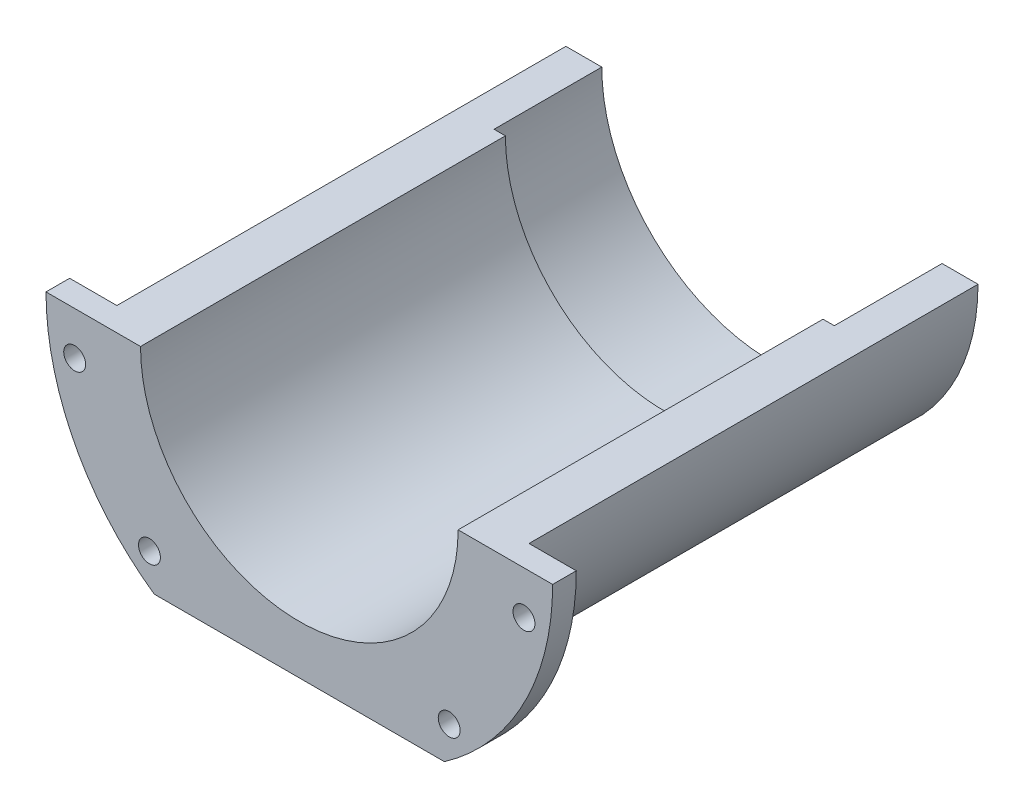
from build123d import *

# Parameters (mm, degrees)
SKETCH1_R               = 27.686
SKETCH1_R_2             = 21.336
BOSS_EXTRUDE1_DEPTH     = 63.5
BOSS_EXTRUDE2_START     = -3.175
SKETCH2_R               = 34.036
SKETCH2_R_2             = 27.686
BOSS_EXTRUDE2_DEPTH     = 3.175
CUT_EXTRUDE1_DEPTH      = 101.6
CUT_EXTRUDE1_DEPTH_BACK = 101.6
SKETCH3_W               = 97.716171251
SKETCH3_H               = 43.59719505
SKETCH4_R               = 1.4732
CUT_EXTRUDE2_DEPTH      = 101.6
SKETCH5_W               = 45.490276776
SKETCH5_H               = 8.374778988
CUT_EXTRUDE3_DEPTH      = 101.6
SKETCH6_R               = 22.86
CUT_EXTRUDE4_DEPTH      = 14.478


with BuildPart() as part:
    # Sketch1 → Boss-Extrude1 (new body)
    with BuildSketch(Plane.XY):
        Circle(SKETCH1_R)
        Circle(SKETCH1_R_2, mode=Mode.SUBTRACT)
    extrude(amount=BOSS_EXTRUDE1_DEPTH)

    # Sketch2 → Boss-Extrude2 (add)
    with BuildSketch(Plane.XY.offset(63.5).offset(BOSS_EXTRUDE2_START)):
        Circle(SKETCH2_R)
        Circle(SKETCH2_R_2, mode=Mode.SUBTRACT)
    extrude(amount=BOSS_EXTRUDE2_DEPTH)

    # Sketch3 → Cut-Extrude1 (cut, two sides: drawn at the far end of the back side and taken through both)
    with BuildSketch(Plane(origin=(0, 0, 60.325), x_dir=(-1, 0, 0), z_dir=(0, 0, -1)).offset(-CUT_EXTRUDE1_DEPTH_BACK)):
        with Locations((3.507260384, 21.798597525)):
            Rectangle(SKETCH3_W, SKETCH3_H)
    extrude(amount=CUT_EXTRUDE1_DEPTH + CUT_EXTRUDE1_DEPTH_BACK, mode=Mode.SUBTRACT)

    # Sketch4 → Cut-Extrude2 (cut)
    with BuildSketch(Plane(origin=(0, 0, 60.325), x_dir=(-1, 0, 0), z_dir=(0, 0, -1))):
        with Locations((-30.183908942, -5.789782577)):
            Circle(SKETCH4_R)
        with Locations((30.183908942, -5.789782577)):
            Circle(SKETCH4_R)
        with Locations((-20.137167868, -23.218191393)):
            Circle(SKETCH4_R)
        with Locations((20.137167868, -23.218191393)):
            Circle(SKETCH4_R)
        with Locations((0, -30.734181969)):
            Circle(SKETCH4_R)
    extrude(amount=-CUT_EXTRUDE2_DEPTH, mode=Mode.SUBTRACT)

    # Sketch5 → Cut-Extrude3 (cut)
    with BuildSketch(Plane(origin=(0, 0, 60.325), x_dir=(-1, 0, 0), z_dir=(0, 0, -1))):
        with Locations((-0.190335886, -32.086257649)):
            Rectangle(SKETCH5_W, SKETCH5_H)
    extrude(amount=-CUT_EXTRUDE3_DEPTH, mode=Mode.SUBTRACT)

    # Sketch6 → Cut-Extrude4 (cut)
    with BuildSketch(Plane(origin=(0, 0, 0), x_dir=(-1, 0, 0), z_dir=(0, 0, -1))):
        Circle(SKETCH6_R)
    extrude(amount=-CUT_EXTRUDE4_DEPTH, mode=Mode.SUBTRACT)


solid = part.part
